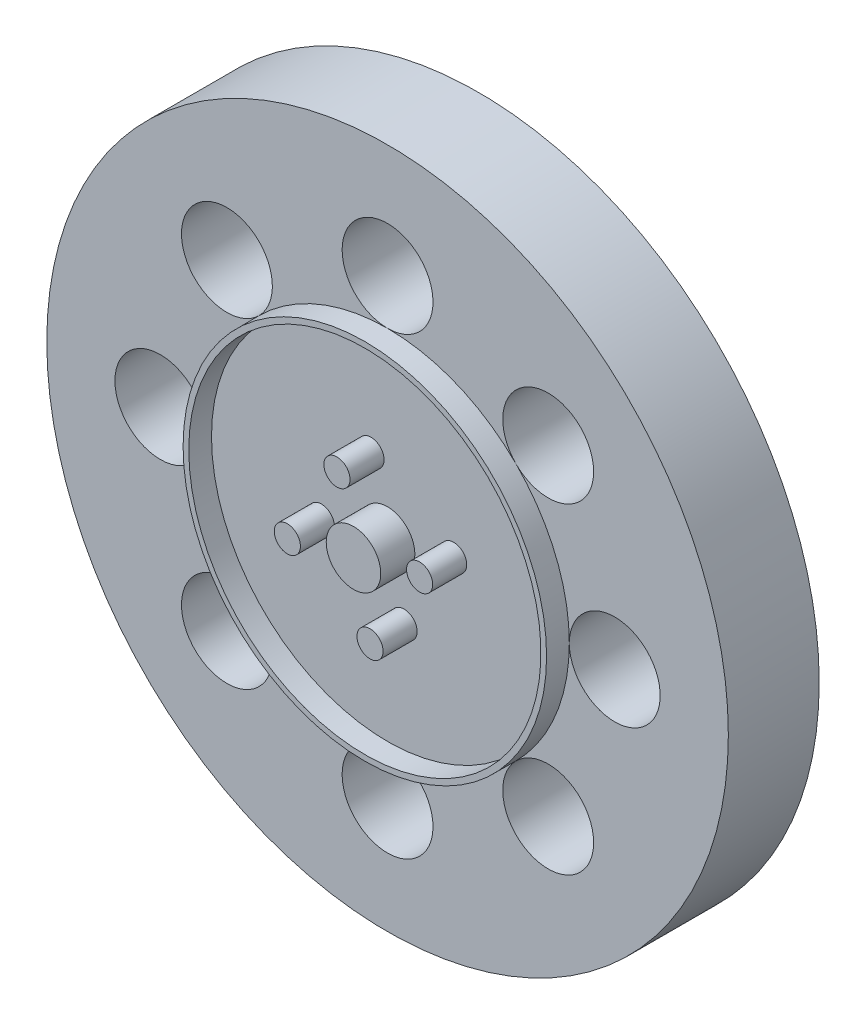
from build123d import *

# Parameters (mm, degrees)
SKETCH_2_R          = 2.4
EXTRUDE_1_DEPTH     = 3
SKETCH_3_R          = 1.15
EXTRUDE_2_DEPTH     = 3
EXTRUDE_2_2_DEPTH   = 3
EXTRUDE_2_3_DEPTH   = 3
EXTRUDE_2_4_DEPTH   = 3
SKETCH_4_R          = 16
SKETCH_4_R_2        = 15.5
EXTRUDE_3_DEPTH     = 2
SKETCH_5_R          = 30
EXTRUDE_4_DEPTH     = 8
CUT_EXTRUDE_1_REACH = 45.829
SKETCH_6_R          = 4
SKETCH_7_R          = 1
CUT_EXTRUDE_2_DEPTH = 4
SKETCH_9_W          = 1
SKETCH_9_H          = 0.6
CUT_EXTRUDE_3_DEPTH = 1


with BuildPart() as part:
    # 草图2 → 凸台-拉伸1 (new body)
    with BuildSketch(Plane(origin=(0, 0, -10), x_dir=(-1, 0, 0), z_dir=(0, 0, -1))):
        Circle(SKETCH_2_R)
    extrude(amount=-EXTRUDE_1_DEPTH)



with BuildPart() as body_2:
    # 草图3 → 凸台-拉伸2 (new body)
    with BuildSketch(Plane(origin=(0, 0, -10), x_dir=(-1, 0, 0), z_dir=(0, 0, -1))):
        with Locations((5.820917719, -1.454962857)):
            Circle(SKETCH_3_R)
    extrude(amount=-EXTRUDE_2_DEPTH)


with BuildPart() as body_3:
    # 草图3 → Extrude 2 2 (new body)
    with BuildSketch(Plane(origin=(0, 0, -10), x_dir=(-1, 0, 0), z_dir=(0, 0, -1))):
        with Locations((-1.454962857, -5.820917719)):
            Circle(SKETCH_3_R)
    extrude(amount=-EXTRUDE_2_2_DEPTH)


with BuildPart() as body_4:
    # 草图3 → Extrude 2 3 (new body)
    with BuildSketch(Plane(origin=(0, 0, -10), x_dir=(-1, 0, 0), z_dir=(0, 0, -1))):
        with Locations((-5.820917719, 1.454962857)):
            Circle(SKETCH_3_R)
    extrude(amount=-EXTRUDE_2_3_DEPTH)


with BuildPart() as body_5:
    # 草图3 → Extrude 2 4 (new body)
    with BuildSketch(Plane(origin=(0, 0, -10), x_dir=(-1, 0, 0), z_dir=(0, 0, -1))):
        with Locations((1.454962857, 5.820917719)):
            Circle(SKETCH_3_R)
    extrude(amount=-EXTRUDE_2_4_DEPTH)


with BuildPart() as body_6:
    # 草图4 → 凸台-拉伸3 (new body)
    with BuildSketch(Plane(origin=(0, 0, -10), x_dir=(-1, 0, 0), z_dir=(0, 0, -1))):
        Circle(SKETCH_4_R)
        Circle(SKETCH_4_R_2, mode=Mode.SUBTRACT)
    extrude(amount=-EXTRUDE_3_DEPTH)


with BuildPart() as part_1:
    add(part.part)

    add(body_2.part)  # 凸台-拉伸4 merges body 2

    add(body_3.part)  # 凸台-拉伸4 merges body 3

    add(body_4.part)  # 凸台-拉伸4 merges body 4

    add(body_5.part)  # 凸台-拉伸4 merges body 5

    add(body_6.part)  # 凸台-拉伸4 merges body 6
    # 草图5 → 凸台-拉伸4 (add)
    with BuildSketch(Plane(origin=(0, 0, -10), x_dir=(-1, 0, 0), z_dir=(0, 0, -1))):
        Circle(SKETCH_5_R)
    extrude(amount=EXTRUDE_4_DEPTH)

    # 草图6 → 切除-拉伸1 (cut, up to next)
    with BuildSketch(Plane(origin=(0, 0, -18), x_dir=(-1, 0, 0), z_dir=(0, 0, -1)), mode=Mode.PRIVATE) as cut_extrude_1_sk1:
        with Locations((0, -20)):
            Circle(SKETCH_6_R)
    cut_extrude_1_tool1 = extrude(cut_extrude_1_sk1.sketch, amount=-CUT_EXTRUDE_1_REACH, mode=Mode.PRIVATE) & part_1.part
    # 草图6 → 切除-拉伸1 (cut, up to next)
    with BuildSketch(Plane(origin=(0, 0, -18), x_dir=(-1, 0, 0), z_dir=(0, 0, -1)), mode=Mode.PRIVATE) as cut_extrude_1_sk2:
        with Locations((-14.142135624, -14.142135624)):
            Circle(SKETCH_6_R)
    cut_extrude_1_tool2 = extrude(cut_extrude_1_sk2.sketch, amount=-CUT_EXTRUDE_1_REACH, mode=Mode.PRIVATE) & part_1.part
    # 草图6 → 切除-拉伸1 (cut, up to next)
    with BuildSketch(Plane(origin=(0, 0, -18), x_dir=(-1, 0, 0), z_dir=(0, 0, -1)), mode=Mode.PRIVATE) as cut_extrude_1_sk3:
        with Locations((-20, 0)):
            Circle(SKETCH_6_R)
    cut_extrude_1_tool3 = extrude(cut_extrude_1_sk3.sketch, amount=-CUT_EXTRUDE_1_REACH, mode=Mode.PRIVATE) & part_1.part
    # 草图6 → 切除-拉伸1 (cut, up to next)
    with BuildSketch(Plane(origin=(0, 0, -18), x_dir=(-1, 0, 0), z_dir=(0, 0, -1)), mode=Mode.PRIVATE) as cut_extrude_1_sk4:
        with Locations((-14.142135624, 14.142135624)):
            Circle(SKETCH_6_R)
    cut_extrude_1_tool4 = extrude(cut_extrude_1_sk4.sketch, amount=-CUT_EXTRUDE_1_REACH, mode=Mode.PRIVATE) & part_1.part
    # 草图6 → 切除-拉伸1 (cut, up to next)
    with BuildSketch(Plane(origin=(0, 0, -18), x_dir=(-1, 0, 0), z_dir=(0, 0, -1)), mode=Mode.PRIVATE) as cut_extrude_1_sk5:
        with Locations((0, 20)):
            Circle(SKETCH_6_R)
    cut_extrude_1_tool5 = extrude(cut_extrude_1_sk5.sketch, amount=-CUT_EXTRUDE_1_REACH, mode=Mode.PRIVATE) & part_1.part
    # 草图6 → 切除-拉伸1 (cut, up to next)
    with BuildSketch(Plane(origin=(0, 0, -18), x_dir=(-1, 0, 0), z_dir=(0, 0, -1)), mode=Mode.PRIVATE) as cut_extrude_1_sk6:
        with Locations((14.142135624, 14.142135624)):
            Circle(SKETCH_6_R)
    cut_extrude_1_tool6 = extrude(cut_extrude_1_sk6.sketch, amount=-CUT_EXTRUDE_1_REACH, mode=Mode.PRIVATE) & part_1.part
    # 草图6 → 切除-拉伸1 (cut, up to next)
    with BuildSketch(Plane(origin=(0, 0, -18), x_dir=(-1, 0, 0), z_dir=(0, 0, -1)), mode=Mode.PRIVATE) as cut_extrude_1_sk7:
        with Locations((20, 0)):
            Circle(SKETCH_6_R)
    cut_extrude_1_tool7 = extrude(cut_extrude_1_sk7.sketch, amount=-CUT_EXTRUDE_1_REACH, mode=Mode.PRIVATE) & part_1.part
    # 草图6 → 切除-拉伸1 (cut, up to next)
    with BuildSketch(Plane(origin=(0, 0, -18), x_dir=(-1, 0, 0), z_dir=(0, 0, -1)), mode=Mode.PRIVATE) as cut_extrude_1_sk8:
        with Locations((14.142135624, -14.142135624)):
            Circle(SKETCH_6_R)
    cut_extrude_1_tool8 = extrude(cut_extrude_1_sk8.sketch, amount=-CUT_EXTRUDE_1_REACH, mode=Mode.PRIVATE) & part_1.part
    add(cut_extrude_1_tool1.solids().sort_by_distance((0, -20, -18))[0], mode=Mode.SUBTRACT)
    add(cut_extrude_1_tool2.solids().sort_by_distance((14.142136, -14.142136, -18))[0], mode=Mode.SUBTRACT)
    add(cut_extrude_1_tool3.solids().sort_by_distance((20, 0, -18))[0], mode=Mode.SUBTRACT)
    add(cut_extrude_1_tool4.solids().sort_by_distance((14.142136, 14.142136, -18))[0], mode=Mode.SUBTRACT)
    add(cut_extrude_1_tool5.solids().sort_by_distance((0, 20, -18))[0], mode=Mode.SUBTRACT)
    add(cut_extrude_1_tool6.solids().sort_by_distance((-14.142136, 14.142136, -18))[0], mode=Mode.SUBTRACT)
    add(cut_extrude_1_tool7.solids().sort_by_distance((-20, 0, -18))[0], mode=Mode.SUBTRACT)
    add(cut_extrude_1_tool8.solids().sort_by_distance((-14.142136, -14.142136, -18))[0], mode=Mode.SUBTRACT)

    # 草图7 → 切除-拉伸2 (cut)
    with BuildSketch(Plane(origin=(0, 0, -18), x_dir=(-1, 0, 0), z_dir=(0, 0, -1))):
        with Locations((12, 0)):
            Circle(SKETCH_7_R)
        with Locations((0, 12)):
            Circle(SKETCH_7_R)
        with Locations((-12, 0)):
            Circle(SKETCH_7_R)
        with Locations((0, -12)):
            Circle(SKETCH_7_R)
    extrude(amount=-CUT_EXTRUDE_2_DEPTH, mode=Mode.SUBTRACT)

    # 草图9 → 切除-拉伸3 (cut)
    with BuildSketch(Plane(origin=(0, 0, -18), x_dir=(-1, 0, 0), z_dir=(0, 0, -1))):
        with Locations((-15, 0)):
            Rectangle(SKETCH_9_W, SKETCH_9_H)
    extrude(amount=-CUT_EXTRUDE_3_DEPTH, mode=Mode.SUBTRACT)


solid = part_1.part
